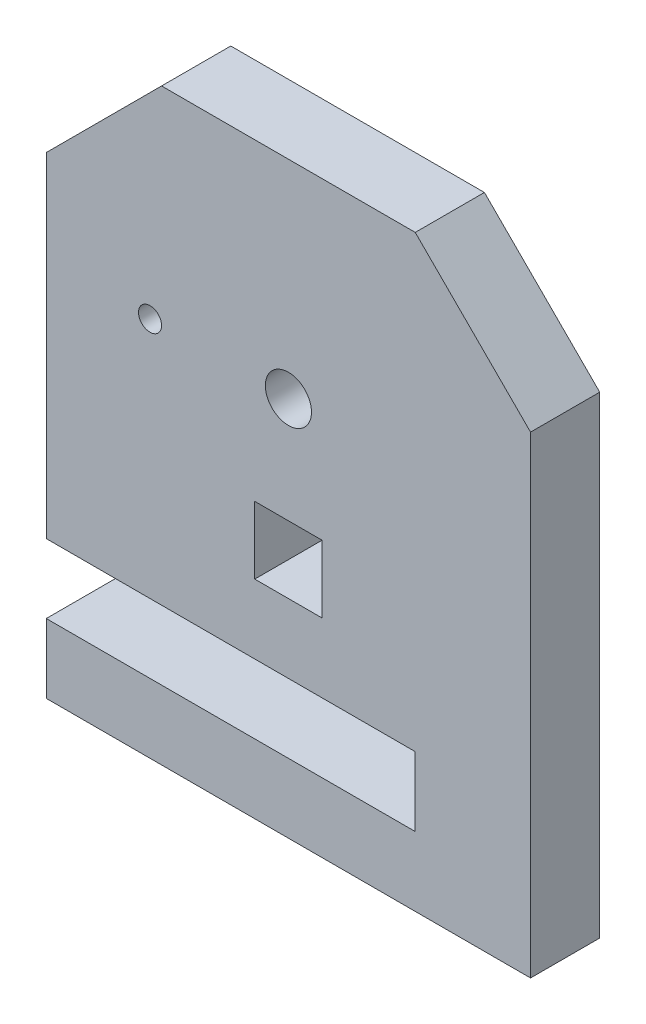
from build123d import *

# Parameters (mm, degrees)
SKETCH1_W           = 2.92
SKETCH1_H           = 2.92
SKETCH1_R           = 0.5
SKETCH1_R_2         = 1
BOSS_EXTRUDE1_DEPTH = 3


with BuildPart() as part:
    # Sketch1 → Boss-Extrude1 (new body)
    with BuildSketch(Plane.XY):
        Polygon((13.5482559, 6.709731544), (8.5482559, 11.709731544), (-2.4517441, 11.709731544), (-7.4517441, 6.709731544), (-7.4517441, -7.790268456), (8.5482559, -7.790268456), (8.5482559, -10.790268456), (-7.4517441, -10.790268456), (-7.4517441, -13.790268456), (13.5482559, -13.790268456), align=None)
        with Locations((3.0482559, -3.330268456)):
            Rectangle(SKETCH1_W, SKETCH1_H, mode=Mode.SUBTRACT)
        with Locations((-2.9517441, 2.709731544)):
            Circle(SKETCH1_R, mode=Mode.SUBTRACT)
        with Locations((3.0482559, 2.709731544)):
            Circle(SKETCH1_R_2, mode=Mode.SUBTRACT)
    extrude(amount=BOSS_EXTRUDE1_DEPTH)


solid = part.part
